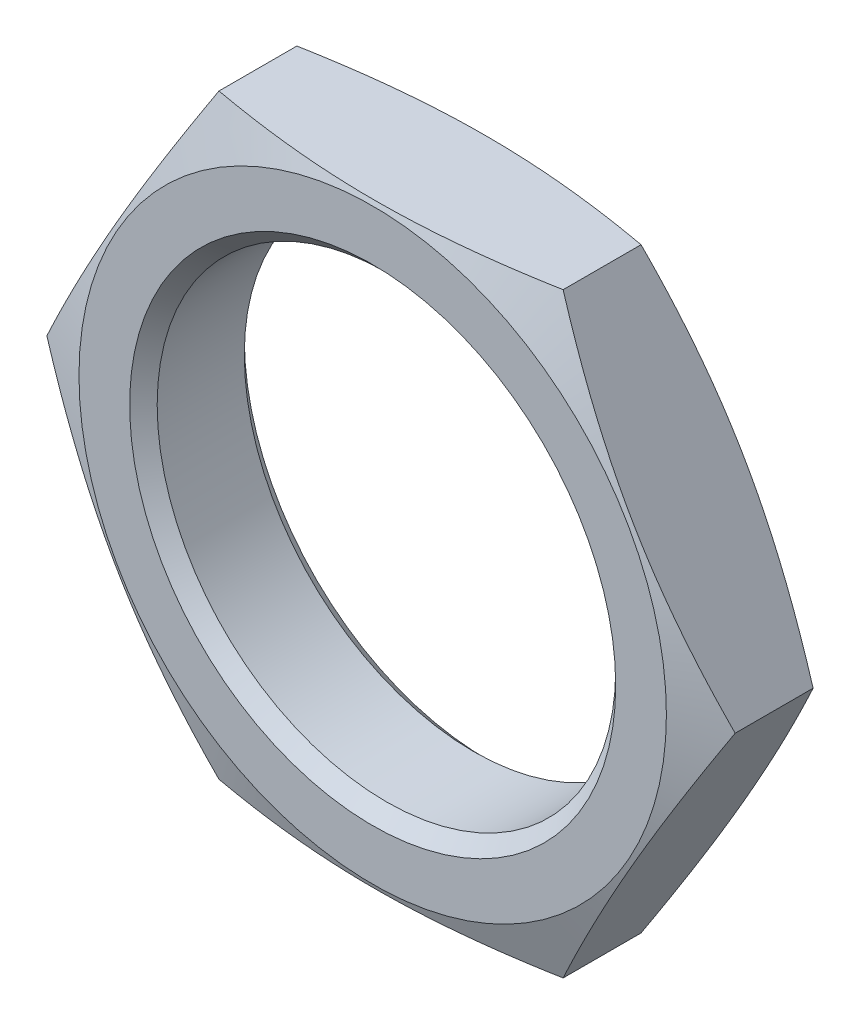
from build123d import *

# Parameters (mm, degrees)
ESQUISSE1_R        = 5
BOSS_EXTRU_1_DEPTH = 2.5
CHANFREIN1_SIZE    = 0.3


with BuildPart() as part:
    # Esquisse1 → Boss.-Extru.1 (new body)
    with BuildSketch(Plane.XY):
        Polygon((7.505553499, 0), (3.75277675, 6.5), (-3.75277675, 6.5), (-7.505553499, 0), (-3.75277675, -6.5), (3.75277675, -6.5), align=None)
        Circle(ESQUISSE1_R, mode=Mode.SUBTRACT)
    extrude(amount=BOSS_EXTRU_1_DEPTH)

    # Esquisse2 → Enlèvement de matière-Révolution1 (revolve, cut)
    with BuildSketch(Plane(origin=(0, 0, 0), x_dir=(1, 0, 0), z_dir=(0, 1, 0))):
        Polygon((-6.405553499, 0), (-7.505553499, -0.400367258), (-7.505553499, -2.099632742), (-6.405553499, -2.5), (-9.005553499, -2.5), (-9.005553499, 0), align=None)
    revolve(axis=Axis((0, 0, 0), (0, 0, 1)), mode=Mode.SUBTRACT)

    # Chanfrein1
    chanfrein1_edges = [part.edges().sort_by_distance(p)[0] for p in [
        (-5, 0, 0),
        (-5, 0, 2.5),
    ]]
    chamfer(chanfrein1_edges, length=CHANFREIN1_SIZE)


solid = part.part
